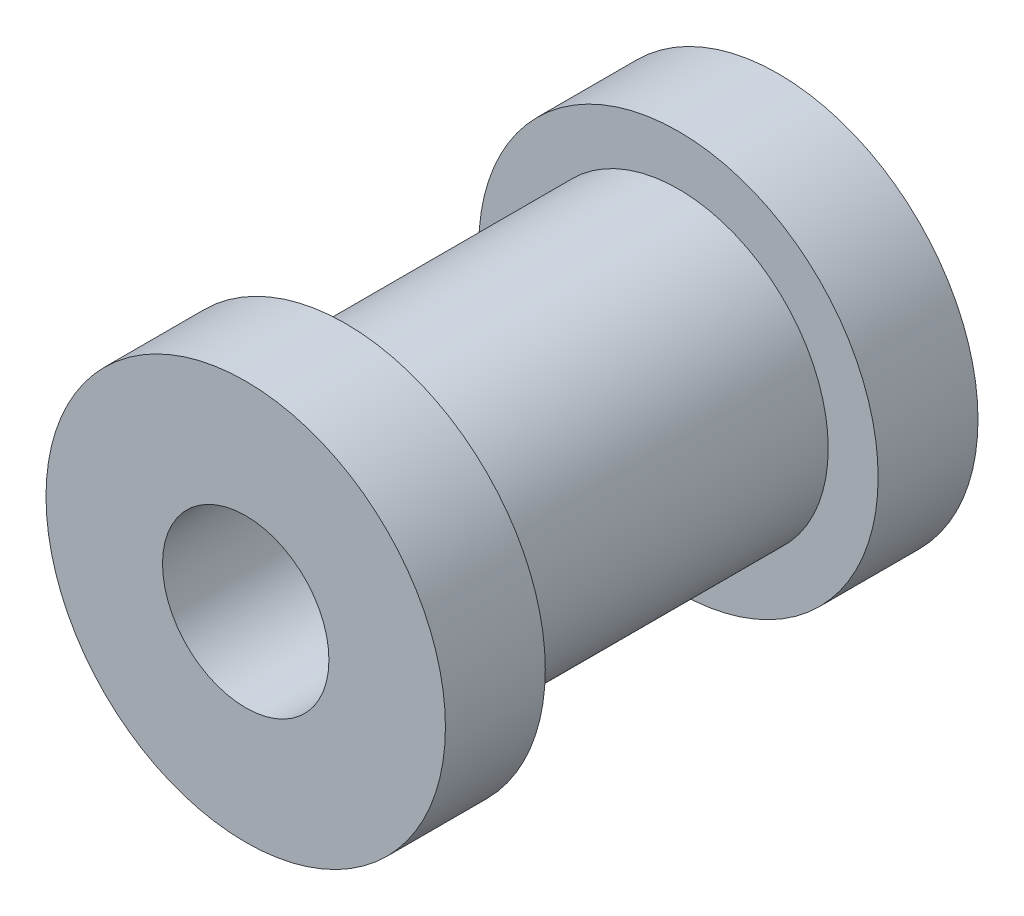
from build123d import *

# Parameters (mm, degrees)
SKETCH_1_R          = 6
SKETCH_1_R_2        = 2.5
EXTRUDE_1_DEPTH     = 16
CUT_EXTRUDE_START   = -10
SKETCH_2_R          = 6
SKETCH_2_R_2        = 4.5
CUT_EXTRUDE_2_DEPTH = 10


with BuildPart() as part:
    # Эскиз1 → Вытянуть1 (new body)
    with BuildSketch(Plane.XY):
        Circle(SKETCH_1_R)
        Circle(SKETCH_1_R_2, mode=Mode.SUBTRACT)
    extrude(amount=EXTRUDE_1_DEPTH)

    # Эскиз2 → Вытянуть2 (cut)
    with BuildSketch(Plane.XY.offset(13).offset(CUT_EXTRUDE_START)):
        Circle(SKETCH_2_R)
        Circle(SKETCH_2_R_2, mode=Mode.SUBTRACT)
    extrude(amount=CUT_EXTRUDE_2_DEPTH, mode=Mode.SUBTRACT)


solid = part.part
